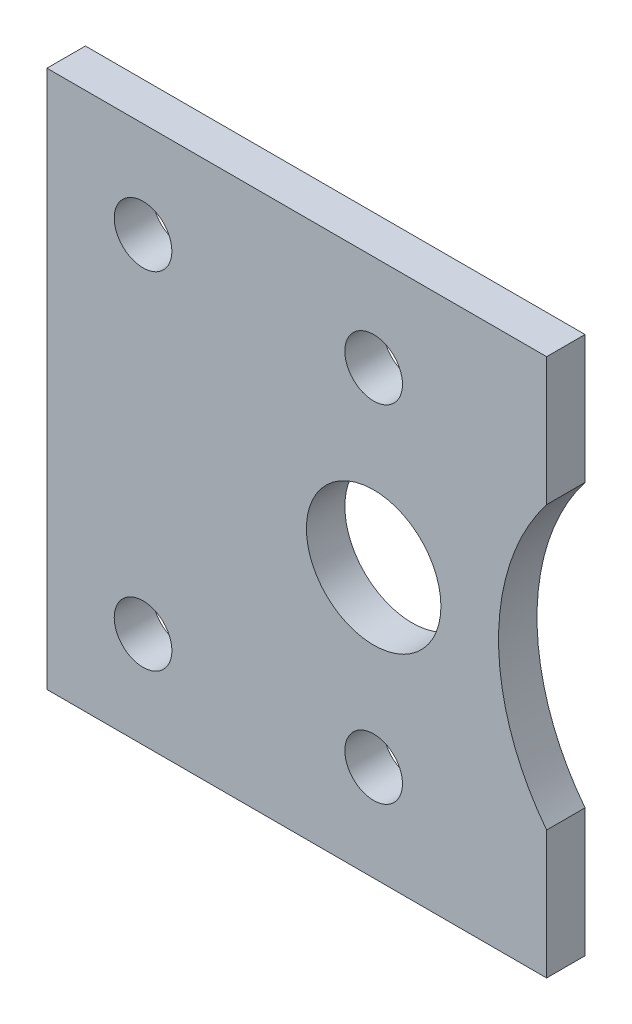
from build123d import *

# Parameters (mm, degrees)
SKETCH1_R           = 3.5
SKETCH1_R_2         = 1.5
BOSS_EXTRUDE1_DEPTH = 2


with BuildPart() as part:
    # Sketch1 → Boss-Extrude1 (new body)
    with BuildSketch(Plane.XY):
        with BuildLine():
            Line((9, -14), (9, -7.331439149))
            ThreePointArc((9, -7.331439149), (6.5, 0), (9, 7.331439149))
            Line((9, 7.331439149), (9, 14))
            Line((9, 14), (-17, 14))
            Line((-17, 14), (-17, -14))
            Line((-17, -14), (9, -14))
        make_face()
        Circle(SKETCH1_R, mode=Mode.SUBTRACT)
        with Locations((-12, 9)):
            Circle(SKETCH1_R_2, mode=Mode.SUBTRACT)
        with Locations((0, 9)):
            Circle(SKETCH1_R_2, mode=Mode.SUBTRACT)
        with Locations(Location((-12, -9, 0), (0, 0, 180))):
            Circle(SKETCH1_R_2, mode=Mode.SUBTRACT)
        with Locations(Location((0, -9, 0), (0, 0, 180))):
            Circle(SKETCH1_R_2, mode=Mode.SUBTRACT)
    extrude(amount=BOSS_EXTRUDE1_DEPTH)


solid = part.part
